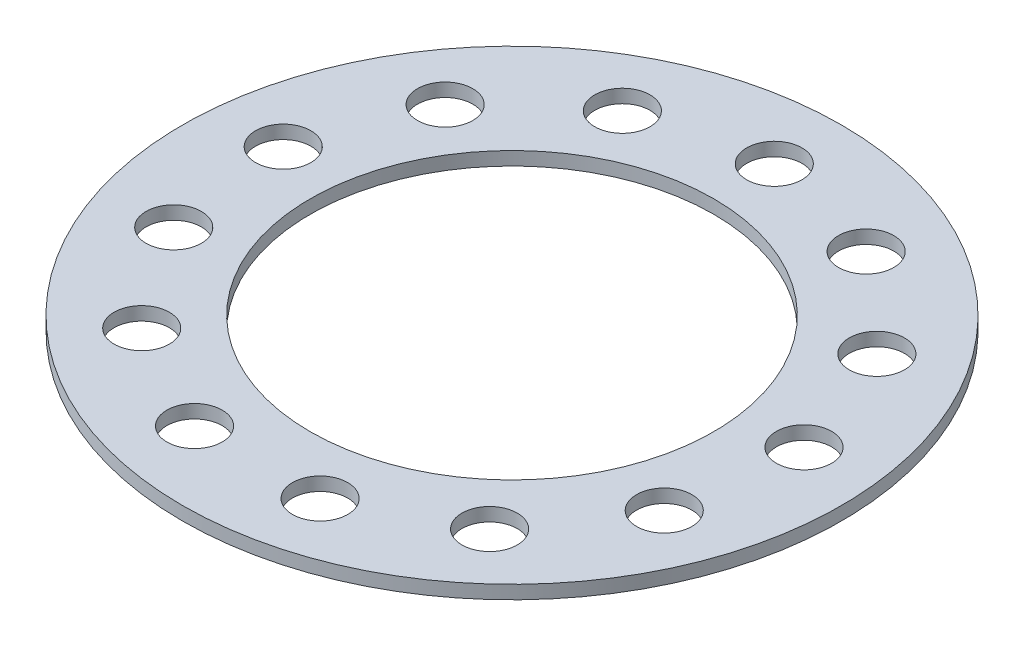
from build123d import *

# Parameters (mm, degrees)
SKETCH1_R           = 24.5
SKETCH1_R_2         = 15
BOSS_EXTRUDE1_DEPTH = 1
SKETCH3_R           = 2.055
CUT_EXTRUDE1_DEPTH  = 35.662660025
CIRPATTERN1_COUNT   = 13


with BuildPart() as part:
    # Sketch1 → Boss-Extrude1 (new body)
    with BuildSketch(Plane(origin=(0, 0, 0), x_dir=(1, 0, 0), z_dir=(0, 1, 0))):
        with Locations(Location((0, 0, 0), (0, 0, 270))):
            Circle(SKETCH1_R)
        with Locations(Location((0, 0, 0), (0, 0, 270))):
            Circle(SKETCH1_R_2, mode=Mode.SUBTRACT)
    extrude(amount=BOSS_EXTRUDE1_DEPTH)

    # Sketch3 → Cut-Extrude1 (cut, through all)
    with BuildSketch(Plane(origin=(0, 1, 0), x_dir=(1, 0, 0), z_dir=(0, 1, 0))):
        with Locations(Location((0, 19.5, 0), (0, 0, 270))):
            Circle(SKETCH3_R)
    cut_extrude1 = extrude(amount=-CUT_EXTRUDE1_DEPTH, mode=Mode.SUBTRACT)

    # CirPattern1: Cut-Extrude1 ×13 about axis
    cirpattern1_axis = Axis((0, 0, 0), (0, 1, 0))
    for i in range(1, CIRPATTERN1_COUNT):
        add(cut_extrude1.rotate(cirpattern1_axis, i * 360 / CIRPATTERN1_COUNT), mode=Mode.SUBTRACT)


solid = part.part
